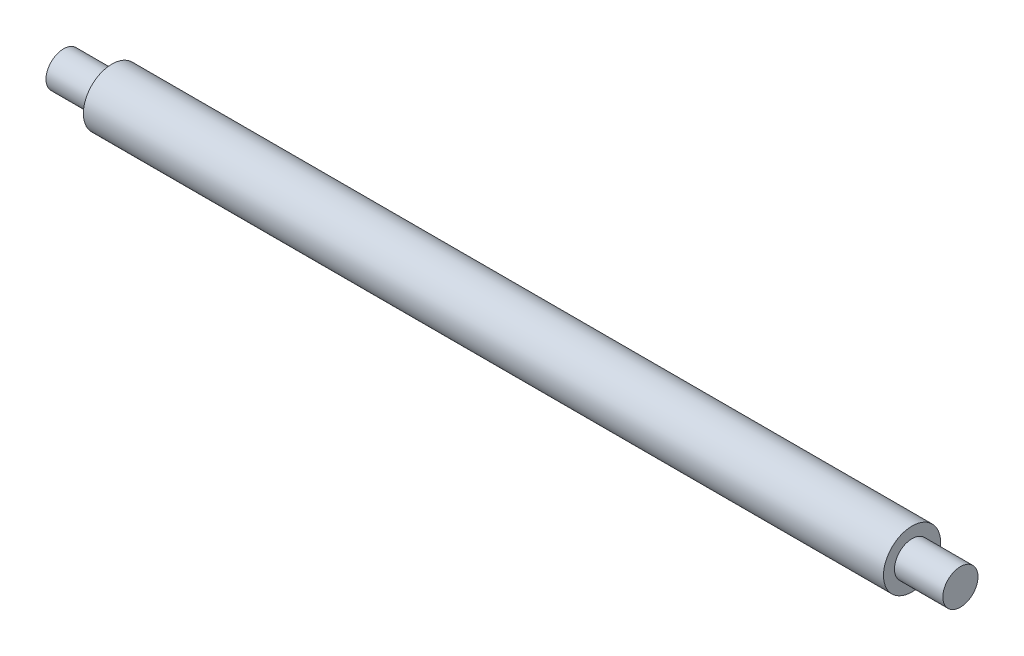
from build123d import *


with BuildPart() as part:
    # Sketch1 → Revolve1 (revolve)
    with BuildSketch(Plane.XY, mode=Mode.PRIVATE) as revolve1_sk:
        Polygon((0, 0), (204, 0), (204, 4), (193, 4), (193, 6.5), (11, 6.5), (11, 4), (0, 4), align=None)
    revolve(revolve1_sk.sketch.rotate(Axis((0, 0, 0), (1, 0, 0)), 180), axis=Axis((0, 0, 0), (1, 0, 0)))


solid = part.part
